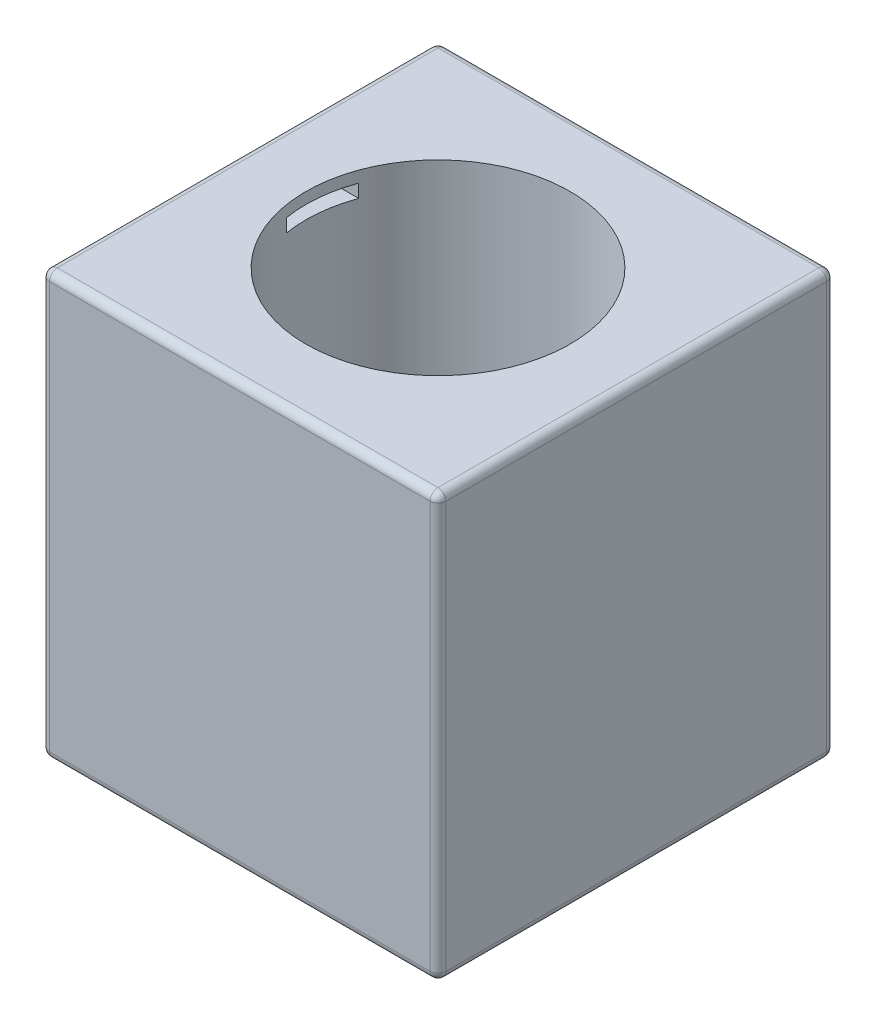
from build123d import *

# Parameters (mm, degrees)
SKETCH6_W               = 150
SKETCH6_H               = 150
SKETCH6_R               = 50
BOSS_EXTRUDE4_DEPTH     = 150
SKETCH7_W               = 150
SKETCH7_H               = 150
BOSS_EXTRUDE5_DEPTH     = 10
SKETCH8_W               = 5
SKETCH8_H               = 10
CUT_EXTRUDE4_DEPTH      = 226
CUT_EXTRUDE5_DEPTH      = 226
CUT_EXTRUDE5_DEPTH_BACK = 226
SKETCH9_W               = 5
SKETCH9_H               = 10
CUT_EXTRUDE6_DEPTH      = 226
CUT_EXTRUDE6_DEPTH_BACK = 13
SKETCH10_W              = 48
SKETCH10_H              = 31
FILLET2_R               = 3
SKETCH18_W              = 100
SKETCH18_H              = 100
CUT_EXTRUDE10_DEPTH     = 13
SKETCH19_W              = 10
SKETCH19_H              = 10
CUT_EXTRUDE11_DEPTH     = 35
SKETCH21_W              = 5
SKETCH21_H              = 5
CUT_EXTRUDE12_DEPTH     = 25.72
SKETCH23_W              = 25
SKETCH23_H              = 5
CUT_EXTRUDE13_DEPTH     = 28
SKETCH24_W              = 5
SKETCH24_H              = 10
BOSS_EXTRUDE6_DEPTH     = 2
SKETCH27_W              = 5
SKETCH27_H              = 10
BOSS_EXTRUDE8_DEPTH     = 2
SKETCH31_W              = 5
SKETCH31_H              = 10
BOSS_EXTRUDE12_DEPTH    = 2
SKETCH32_W              = 5
SKETCH32_H              = 10
BOSS_EXTRUDE13_DEPTH    = 2


with BuildPart() as part:
    # Sketch6 → Boss-Extrude4 (new body)
    with BuildSketch(Plane(origin=(0, 0, 0), x_dir=(1, 0, 0), z_dir=(0, 1, 0))):
        Rectangle(SKETCH6_W, SKETCH6_H)
        with Locations(Location((0, 0, 0), (0, 0, 270))):
            Circle(SKETCH6_R, mode=Mode.SUBTRACT)
    extrude(amount=BOSS_EXTRUDE4_DEPTH)

    # Sketch7 → Boss-Extrude5 (add)
    with BuildSketch(Plane.XZ):
        Rectangle(SKETCH7_W, SKETCH7_H)
    extrude(amount=BOSS_EXTRUDE5_DEPTH)

    # Sketch8 → Cut-Extrude4 (cut, symmetric)
    with BuildSketch(Plane.XY.offset(75)):
        with Locations((59.5, 70)):
            Rectangle(SKETCH8_W, SKETCH8_H)
    cut_extrude4 = extrude(amount=CUT_EXTRUDE4_DEPTH, both=True, mode=Mode.SUBTRACT)

    # Mirror4: Cut-Extrude4 across plane
    add(cut_extrude4.mirror(Plane(origin=(0, 0, 0), x_dir=(0, 0, 1), z_dir=(1, 0, 0))), mode=Mode.SUBTRACT)

    # Sketch9 → Cut-Extrude5 (cut, two sides: drawn at the far end of the back side and taken through both)
    with BuildSketch(Plane(origin=(75, 0, 0), x_dir=(0, 0, -1), z_dir=(1, 0, 0)).offset(-CUT_EXTRUDE5_DEPTH_BACK)):
        with Locations((59.5, 70)):
            Rectangle(SKETCH9_W, SKETCH9_H)
    extrude(amount=CUT_EXTRUDE5_DEPTH + CUT_EXTRUDE5_DEPTH_BACK, mode=Mode.SUBTRACT)

    # Sketch10 → Cut-Extrude6 (cut, two sides: drawn at the far end of the back side and taken through both)
    with BuildSketch(Plane(origin=(0, 0, -75), x_dir=(-1, 0, 0), z_dir=(0, 0, -1)).offset(-CUT_EXTRUDE6_DEPTH_BACK)):
        with Locations((0, 70)):
            Rectangle(SKETCH10_W, SKETCH10_H)
    extrude(amount=CUT_EXTRUDE6_DEPTH + CUT_EXTRUDE6_DEPTH_BACK, mode=Mode.SUBTRACT)

    # Fillet2
    fillet2_edges = [part.edges().sort_by_distance(p)[0] for p in [
        (-75, 150, 0),
        (0, 150, 75),
        (0, -10, -75),
        (75, -10, 0),
        (0, -10, 75),
        (-75, -10, 0),
        (75, 150, 0),
        (75, 70, 75),
        (-75, 70, 75),
        (-75, 70, -75),
        (75, 70, -75),
        (0, 150, -75),
    ]]
    fillet(fillet2_edges, radius=FILLET2_R)

    # Sketch18 → Cut-Extrude10 (cut)
    with BuildSketch(Plane.ZY.offset(75)):
        with Locations((0, 70)):
            Rectangle(SKETCH18_W, SKETCH18_H)
    extrude(amount=-CUT_EXTRUDE10_DEPTH, mode=Mode.SUBTRACT)

    # Sketch19 → Cut-Extrude11 (cut)
    with BuildSketch(Plane(origin=(0, 20, 0), x_dir=(1, 0, 0), z_dir=(0, 1, 0))):
        with Locations((-68, 6.512866789)):
            Rectangle(SKETCH19_W, SKETCH19_H)
    extrude(amount=-CUT_EXTRUDE11_DEPTH, mode=Mode.SUBTRACT)

    # Sketch21 → Cut-Extrude12 (cut)
    with BuildSketch(Plane.XZ.offset(-120)):
        with Locations((-70.5, -6.339504826)):
            Rectangle(SKETCH21_W, SKETCH21_H)
    extrude(amount=-CUT_EXTRUDE12_DEPTH, mode=Mode.SUBTRACT)

    # Sketch23 → Cut-Extrude13 (cut)
    with BuildSketch(Plane.ZY.offset(42)):
        with Locations((-4.5, 143.222196011)):
            Rectangle(SKETCH23_W, SKETCH23_H)
    extrude(amount=CUT_EXTRUDE13_DEPTH, mode=Mode.SUBTRACT)

    # Sketch24 → Boss-Extrude6 (add)
    with BuildSketch(Plane.XY.offset(75)):
        with Locations((-59.5, 70)):
            Rectangle(SKETCH24_W, SKETCH24_H)
        with Locations((59.5, 70)):
            Rectangle(SKETCH24_W, SKETCH24_H)
    extrude(amount=-BOSS_EXTRUDE6_DEPTH)

    # Sketch27 → Boss-Extrude8 (add)
    with BuildSketch(Plane(origin=(0, 0, -75), x_dir=(-1, 0, 0), z_dir=(0, 0, -1))):
        with Locations((59.5, 70)):
            Rectangle(SKETCH27_W, SKETCH27_H)
        with Locations((-59.5, 70)):
            Rectangle(SKETCH27_W, SKETCH27_H)
    extrude(amount=-BOSS_EXTRUDE8_DEPTH)

    # Sketch31 → Boss-Extrude12 (add)
    with BuildSketch(Plane(origin=(75, 0, 0), x_dir=(0, 0, -1), z_dir=(1, 0, 0))):
        with Locations((59.5, 70)):
            Rectangle(SKETCH31_W, SKETCH31_H)
    extrude(amount=-BOSS_EXTRUDE12_DEPTH)

    # Sketch32 → Boss-Extrude13 (add)
    with BuildSketch(Plane.ZY.offset(75)):
        with Locations((-59.5, 70)):
            Rectangle(SKETCH32_W, SKETCH32_H)
    extrude(amount=-BOSS_EXTRUDE13_DEPTH)


solid = part.part
